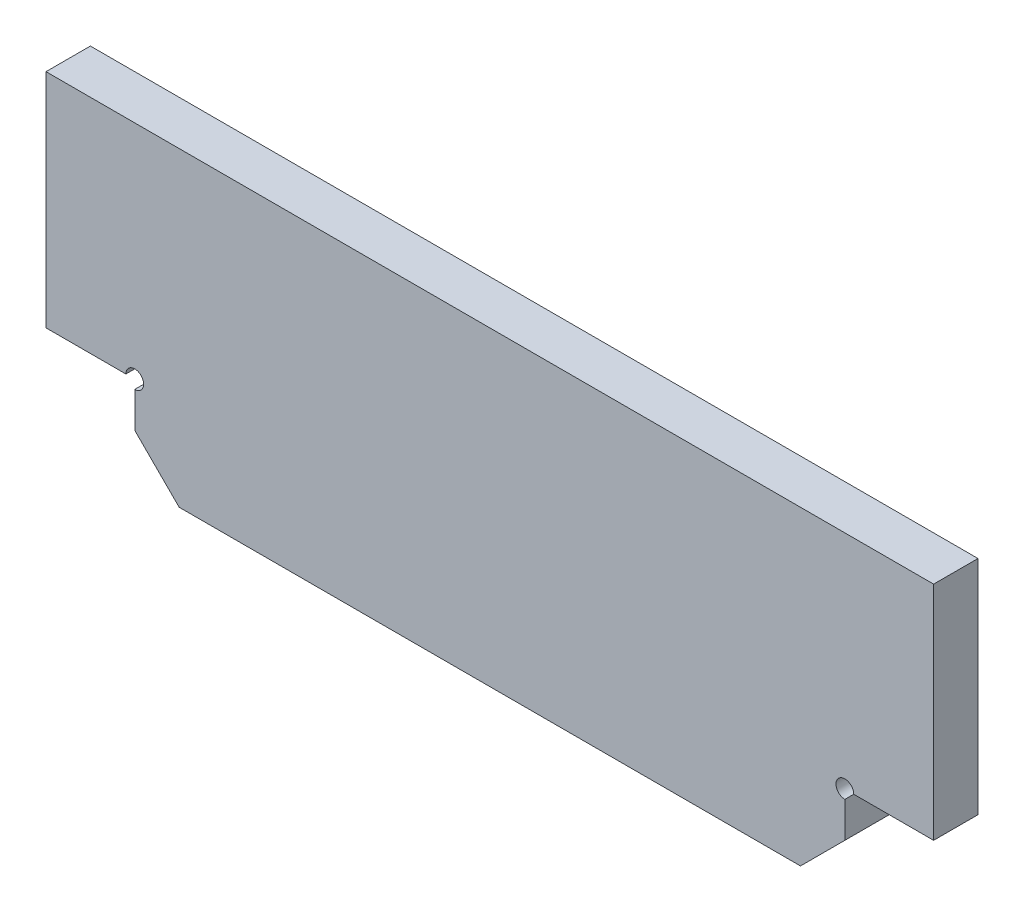
from build123d import *

# Parameters (mm, degrees)
EXTRUDE_1_DEPTH = 2.5


with BuildPart() as part:
    # 草圖1 → 填料-伸長1 (new, symmetric)
    with BuildSketch(Plane.XY):
        with BuildLine():
            Line((-40, 5), (-35, 0))
            Line((-35, 0), (35, 0))
            Line((35, 0), (40, 5))
            Line((40, 5), (40, 9))
            ThreePointArc((40, 9), (39.292893219, 10.707106781), (41, 10))
            Line((41, 10), (50, 10))
            Line((50, 10), (50, 35))
            Line((50, 35), (-50, 35))
            Line((-50, 35), (-50, 10))
            Line((-50, 10), (-41, 10))
            ThreePointArc((-41, 10), (-39.292893219, 10.707106781), (-40, 9))
            Line((-40, 9), (-40, 5))
        make_face()
    extrude(amount=EXTRUDE_1_DEPTH, both=True)


solid = part.part
